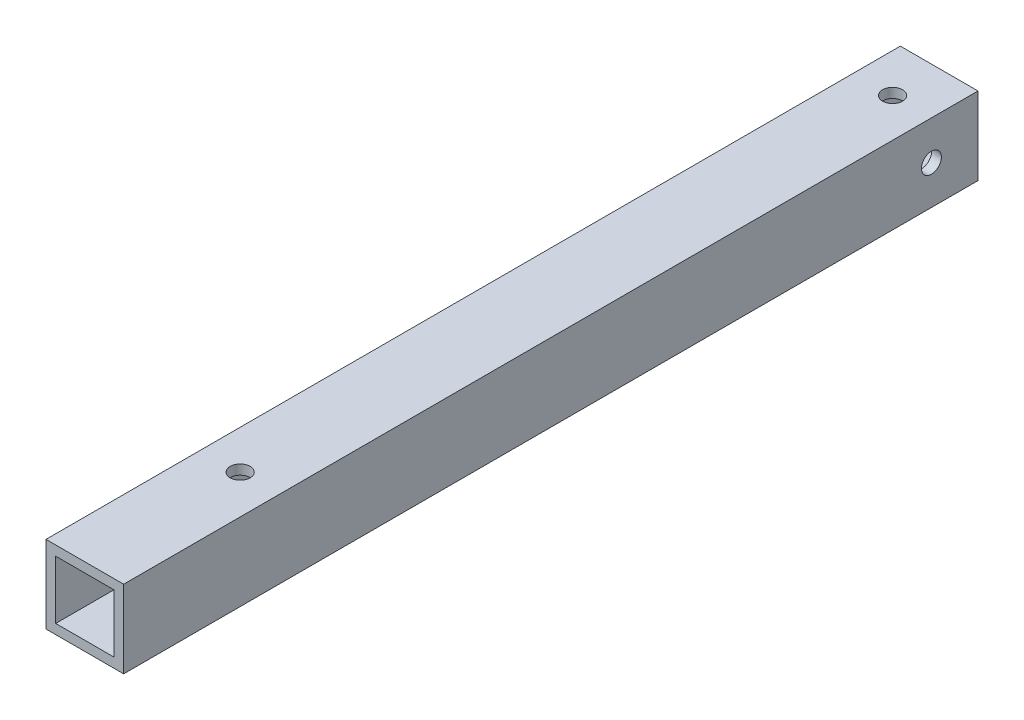
from build123d import *

# Parameters (mm, degrees)
SKETCH2_W           = 25.4
SKETCH2_H           = 25.4
BOSS_EXTRUDE1_DEPTH = 279.4
SKETCH4_W           = 19.05
SKETCH4_H           = 19.05
CUT_EXTRUDE1_DEPTH  = 280.9766776
SKETCH5_R           = 3.2639
CUT_EXTRUDE2_DEPTH  = 281.839473721
SKETCH6_R           = 3.2639
CUT_EXTRUDE3_DEPTH  = 281.839473721
SKETCH7_R           = 3.2639
CUT_EXTRUDE4_DEPTH  = 281.839473721


with BuildPart() as part:
    # Sketch2 → Boss-Extrude1 (new body)
    with BuildSketch(Plane.XY):
        Rectangle(SKETCH2_W, SKETCH2_H)
    extrude(amount=BOSS_EXTRUDE1_DEPTH)

    # Sketch4 → Cut-Extrude1 (cut, through all)
    with BuildSketch(Plane.XY):
        Rectangle(SKETCH4_W, SKETCH4_H)
    extrude(amount=CUT_EXTRUDE1_DEPTH, mode=Mode.SUBTRACT)

    # Sketch5 → Cut-Extrude2 (cut, through all)
    with BuildSketch(Plane(origin=(0, 12.7, 0), x_dir=(1, 0, 0), z_dir=(0, 1, 0))):
        with Locations(Location((0, -15.24, 0), (0, 0, 270))):
            Circle(SKETCH5_R)
    extrude(amount=-CUT_EXTRUDE2_DEPTH, mode=Mode.SUBTRACT)

    # Sketch6 → Cut-Extrude3 (cut, through all)
    with BuildSketch(Plane(origin=(0, 12.7, 0), x_dir=(1, 0, 0), z_dir=(0, 1, 0))):
        with Locations(Location((0, -228.6, 0), (0, 0, 270))):
            Circle(SKETCH6_R)
    extrude(amount=-CUT_EXTRUDE3_DEPTH, mode=Mode.SUBTRACT)

    # Sketch7 → Cut-Extrude4 (cut, through all)
    with BuildSketch(Plane.ZY.offset(12.7)):
        with Locations((15.24, 0)):
            Circle(SKETCH7_R)
    extrude(amount=-CUT_EXTRUDE4_DEPTH, mode=Mode.SUBTRACT)


solid = part.part
